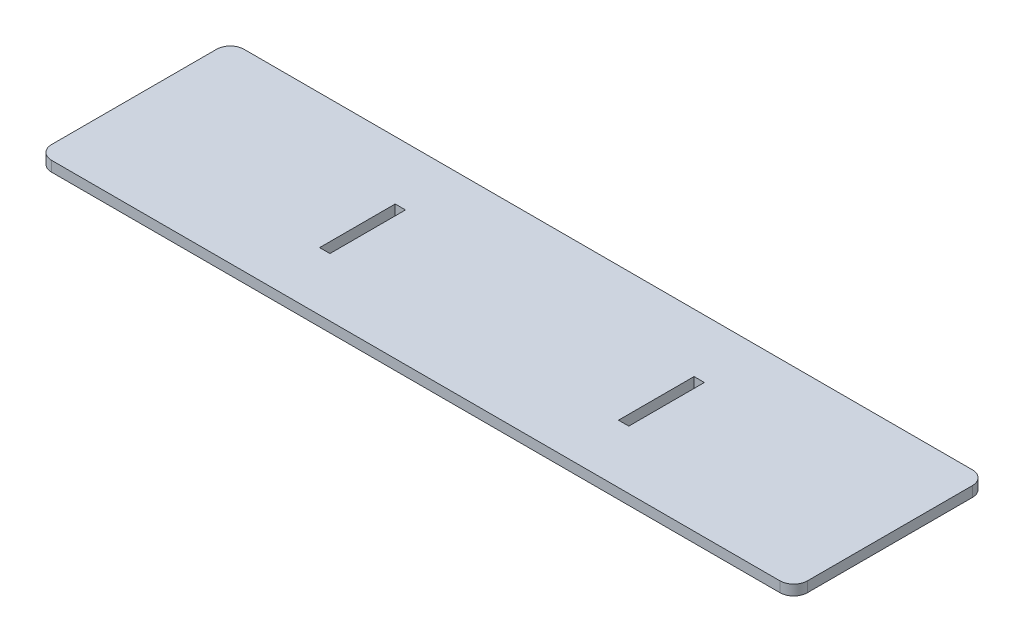
from build123d import *

# Parameters (mm, degrees)
BOSS_EXTRUDE1_DEPTH     = 3
CUT_EXTRUDE1_DEPTH      = 114.547346953
CUT_EXTRUDE1_DEPTH_BACK = 114.547346953
SKETCH2_W               = 3
SKETCH2_H               = 22


with BuildPart() as part:
    # Sketch1 → Boss-Extrude1 (new body)
    with BuildSketch(Plane(origin=(0, 0, 0), x_dir=(1, 0, 0), z_dir=(0, 1, 0))):
        with BuildLine():
            Line((-106, -28), (106, -28))
            ThreePointArc((106, -28), (108.828427125, -26.828427125), (110, -24))
            Line((110, -24), (110, 24))
            ThreePointArc((110, 24), (108.828427125, 26.828427125), (106, 28))
            Line((106, 28), (-106, 28))
            ThreePointArc((-106, 28), (-108.828427125, 26.828427125), (-110, 24))
            Line((-110, 24), (-110, -24))
            ThreePointArc((-110, -24), (-108.828427125, -26.828427125), (-106, -28))
        make_face()
    extrude(amount=BOSS_EXTRUDE1_DEPTH)

    # Sketch2 → Cut-Extrude1 (cut, two sides: drawn at the far end of the back side and taken through both)
    with BuildSketch(Plane(origin=(0, 0, 0), x_dir=(1, 0, 0), z_dir=(0, 1, 0)).offset(-CUT_EXTRUDE1_DEPTH_BACK)):
        with Locations((-43.5, 0)):
            Rectangle(SKETCH2_W, SKETCH2_H)
        with Locations((43.5, 0)):
            Rectangle(SKETCH2_W, SKETCH2_H)
    extrude(amount=CUT_EXTRUDE1_DEPTH + CUT_EXTRUDE1_DEPTH_BACK, mode=Mode.SUBTRACT)


solid = part.part
